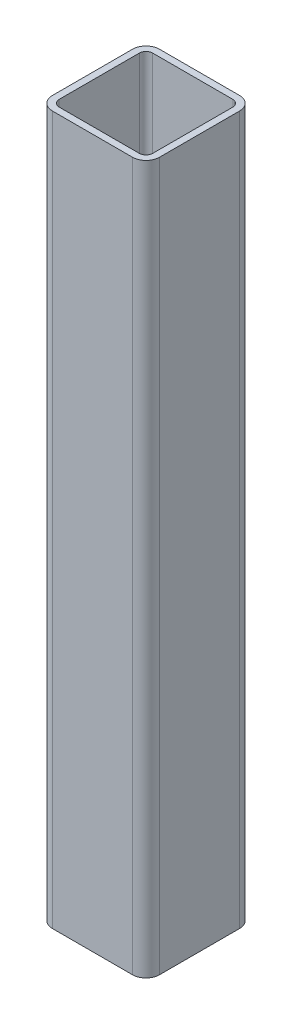
from build123d import *

# Parameters (mm, degrees)
SQUARE_TUBE_20_X_20_X_2_3_DEPTH = 210


with BuildPart() as part:
    # Sketch1 → Square tube 20 X 20 X 2(3) (new body)
    with BuildSketch(Plane(origin=(0, 0, 0), x_dir=(1, 0, 0), z_dir=(0, 1, 0))):
        with BuildLine():
            Line((-11.875, -15.875), (11.875, -15.875))
            ThreePointArc((11.875, -15.875), (14.703427125, -14.703427125), (15.875, -11.875))
            Line((15.875, -11.875), (15.875, 11.875))
            ThreePointArc((15.875, 11.875), (14.703427125, 14.703427125), (11.875, 15.875))
            Line((11.875, 15.875), (-11.875, 15.875))
            ThreePointArc((-11.875, 15.875), (-14.703427125, 14.703427125), (-15.875, 11.875))
            Line((-15.875, 11.875), (-15.875, -11.875))
            ThreePointArc((-15.875, -11.875), (-14.703427125, -14.703427125), (-11.875, -15.875))
        make_face()
        with BuildLine():
            Line((-11.875, -13.875), (11.875, -13.875))
            ThreePointArc((11.875, -13.875), (13.289213562, -13.289213562), (13.875, -11.875))
            Line((13.875, -11.875), (13.875, 11.875))
            ThreePointArc((13.875, 11.875), (13.289213562, 13.289213562), (11.875, 13.875))
            Line((11.875, 13.875), (-11.875, 13.875))
            ThreePointArc((-11.875, 13.875), (-13.289213562, 13.289213562), (-13.875, 11.875))
            Line((-13.875, 11.875), (-13.875, -11.875))
            ThreePointArc((-13.875, -11.875), (-13.289213562, -13.289213562), (-11.875, -13.875))
        make_face(mode=Mode.SUBTRACT)
    extrude(amount=SQUARE_TUBE_20_X_20_X_2_3_DEPTH)


solid = part.part
